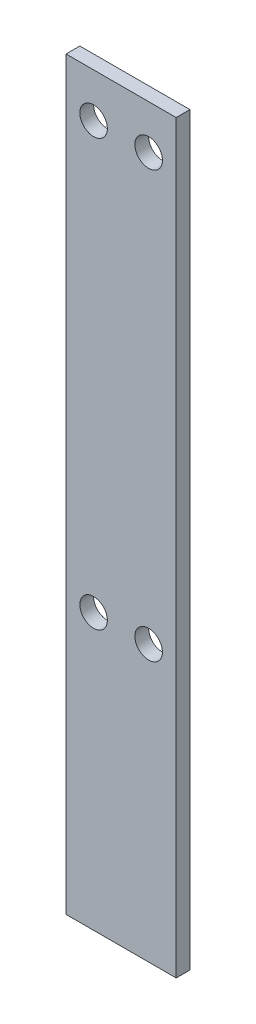
from build123d import *

# Parameters (mm, degrees)
SKETCH1_W           = 38.1
SKETCH1_H           = 257.81
SKETCH1_R           = 4.7625
BOSS_EXTRUDE1_DEPTH = 4.7625


with BuildPart() as part:
    # Sketch1 → Boss-Extrude1 (new body)
    with BuildSketch(Plane.XY):
        with Locations((19.05, 128.905)):
            Rectangle(SKETCH1_W, SKETCH1_H)
        with Locations(Location((9.525, 95.25, 0), (0, 0, 180))):
            Circle(SKETCH1_R, mode=Mode.SUBTRACT)
        with Locations(Location((28.575, 95.25, 0), (0, 0, 180))):
            Circle(SKETCH1_R, mode=Mode.SUBTRACT)
        with Locations(Location((9.525, 242.57, 0), (0, 0, 180))):
            Circle(SKETCH1_R, mode=Mode.SUBTRACT)
        with Locations(Location((28.575, 242.57, 0), (0, 0, 180))):
            Circle(SKETCH1_R, mode=Mode.SUBTRACT)
    extrude(amount=BOSS_EXTRUDE1_DEPTH)


solid = part.part
